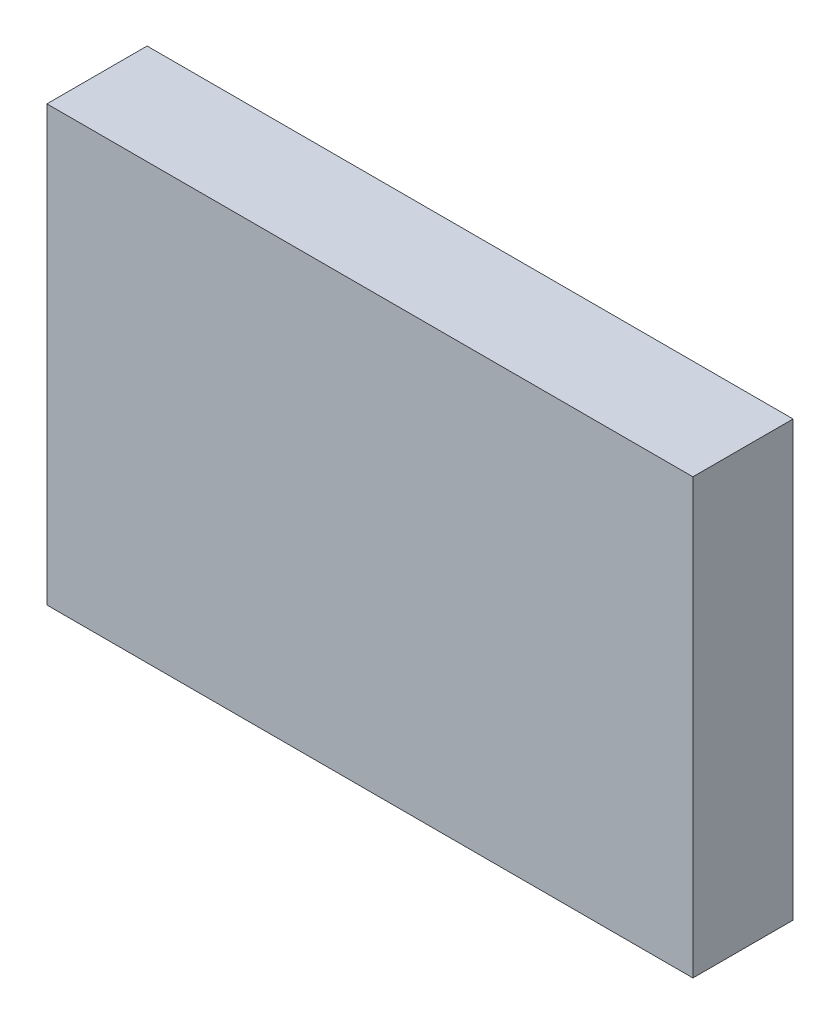
from build123d import *

# Parameters (mm, degrees)
ESQUISSE1_W             = 87.0635
ESQUISSE1_H             = 58.5
COMPONENT_OUTLINE_DEPTH = 13.5


with BuildPart() as part:
    # Esquisse1 → Component_Outline (new body)
    with BuildSketch(Plane.XY):
        with Locations((43.46825, 26.75)):
            Rectangle(ESQUISSE1_W, ESQUISSE1_H)
    extrude(amount=COMPONENT_OUTLINE_DEPTH)


solid = part.part
